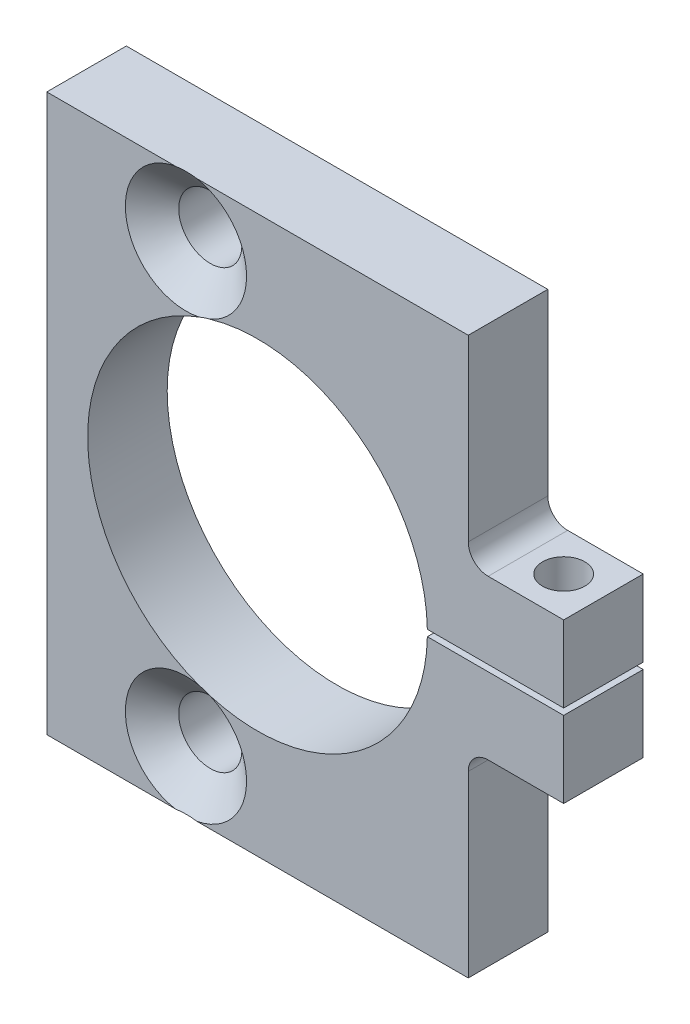
from build123d import *

# Parameters (mm, degrees)
SKETCH1_W               = 82.55
SKETCH1_H               = 88.9
EXTRUDE1_DEPTH          = 12.7
SKETCH2_R               = 27.1272
EXTRUDE2_DEPTH          = 62.973527615
SKETCH3_W               = 28.468633454
SKETCH3_H               = 1.016
EXTRUDE3_DEPTH          = 62.973527615
F_1_4_CLEARANCE_HOLE1_D = 6.7564
SKETCH10_W              = 15.24
SKETCH10_H              = 31.75
EXTRUDE4_DEPTH          = 62.973527707
FILLET1_R               = 3.175


with BuildPart() as part:
    # Sketch1 → Extrude1 (new body)
    with BuildSketch(Plane.XY):
        Rectangle(SKETCH1_W, SKETCH1_H)
    extrude(amount=EXTRUDE1_DEPTH)

    # Sketch2 → Extrude2 (cut, through all)
    with BuildSketch(Plane.XY.offset(12.7)):
        with Locations((-7.62, 0)):
            Circle(SKETCH2_R)
    extrude(amount=-EXTRUDE2_DEPTH, mode=Mode.SUBTRACT)

    # Sketch3 → Extrude3 (cut, through all)
    with BuildSketch(Plane.XY.offset(12.7)):
        with Locations((30.3911, 0)):
            Rectangle(SKETCH3_W, SKETCH3_H)
    extrude(amount=-EXTRUDE3_DEPTH, mode=Mode.SUBTRACT)

    # 1/4 Clearance Hole1 (through all)
    with Locations(Plane(origin=(34.925, 44.45, 6.35), x_dir=(0, 0, 1), z_dir=(0, 1, 0))):
        with Locations((0, 0)):
            Hole(F_1_4_CLEARANCE_HOLE1_D / 2)

    # Sketch9 → CSK for 3/8 Flat Head Machine Screw (100)1 (revolve, cut)
    with BuildSketch(Plane(origin=(-19.05, 34.925, 12.7), x_dir=(0, -1, 0), z_dir=(1, 0, 0))):
        Polygon((0, 0), (0, 14.459479155), (5.0419, 11.43), (5.0419, 3.88964634), (9.6774, 0), align=None)
    csk_for_3_8_flat_head_machine_screw_100 = revolve(axis=Axis((-19.05, 34.925, 19.05), (0, 0, -1)), mode=Mode.SUBTRACT)

    # Mirror1: CSK for 3/8 Flat Head Machine Screw (100)1 across plane
    add(csk_for_3_8_flat_head_machine_screw_100.mirror(Plane.ZX), mode=Mode.SUBTRACT)

    # Sketch10 → Extrude4 (cut, through all)
    with BuildSketch(Plane.XY.offset(12.7)):
        with Locations((33.655, 28.575)):
            Rectangle(SKETCH10_W, SKETCH10_H)
    extrude4 = extrude(amount=-EXTRUDE4_DEPTH, mode=Mode.SUBTRACT)

    # Mirror2: Extrude4 across plane
    add(extrude4.mirror(Plane.ZX), mode=Mode.SUBTRACT)

    # Fillet1
    fillet1_edges = [part.edges().sort_by_distance(p)[0] for p in [
        (26.035, -12.7, 6.35),
        (26.035, 12.7, 6.35),
    ]]
    fillet(fillet1_edges, radius=FILLET1_R)


solid = part.part
